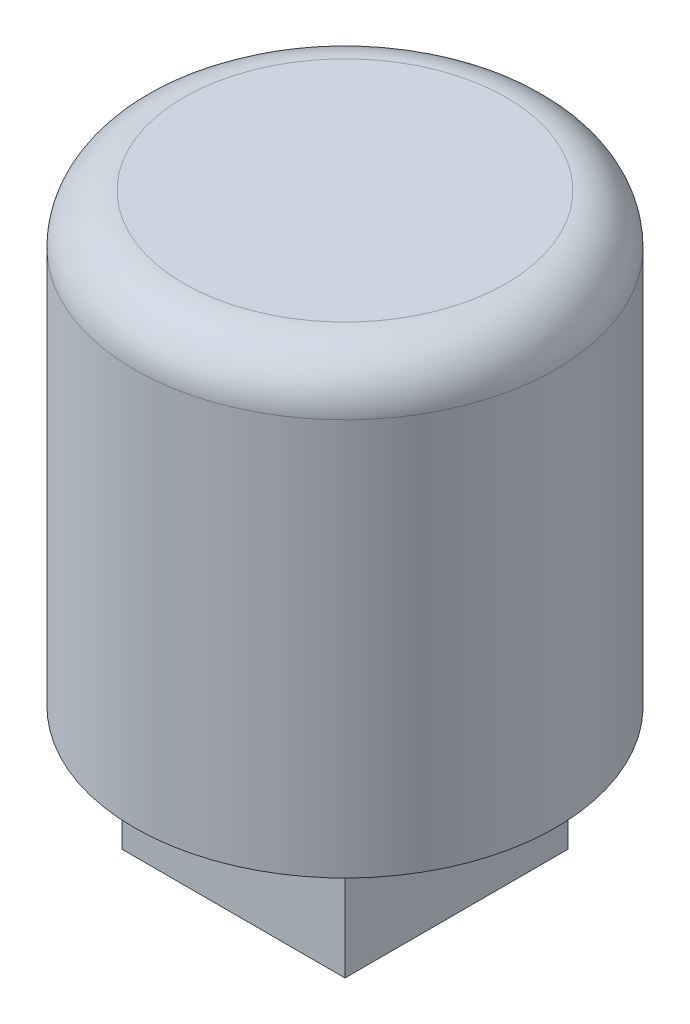
from build123d import *

# Parameters (mm, degrees)
SKETCH1_R           = 85
BOSS_EXTRUDE2_DEPTH = 180
SKETCH2_W           = 90
SKETCH2_H           = 90
BOSS_EXTRUDE3_DEPTH = 50
FILLET1_R           = 20


with BuildPart() as part:
    # Sketch1 → Boss-Extrude2 (new body)
    with BuildSketch(Plane(origin=(0, 0, 0), x_dir=(1, 0, 0), z_dir=(0, 1, 0))):
        with Locations(Location((0, 0, 0), (0, 0, 90))):
            Circle(SKETCH1_R)
    extrude(amount=BOSS_EXTRUDE2_DEPTH)

    # Sketch2 → Boss-Extrude3 (add)
    with BuildSketch(Plane.XZ):
        Rectangle(SKETCH2_W, SKETCH2_H)
    extrude(amount=BOSS_EXTRUDE3_DEPTH)

    # Fillet1
    fillet1_edges = [part.edges().sort_by_distance(p)[0] for p in [
        (0, 180, 85),
    ]]
    fillet(fillet1_edges, radius=FILLET1_R)


solid = part.part
